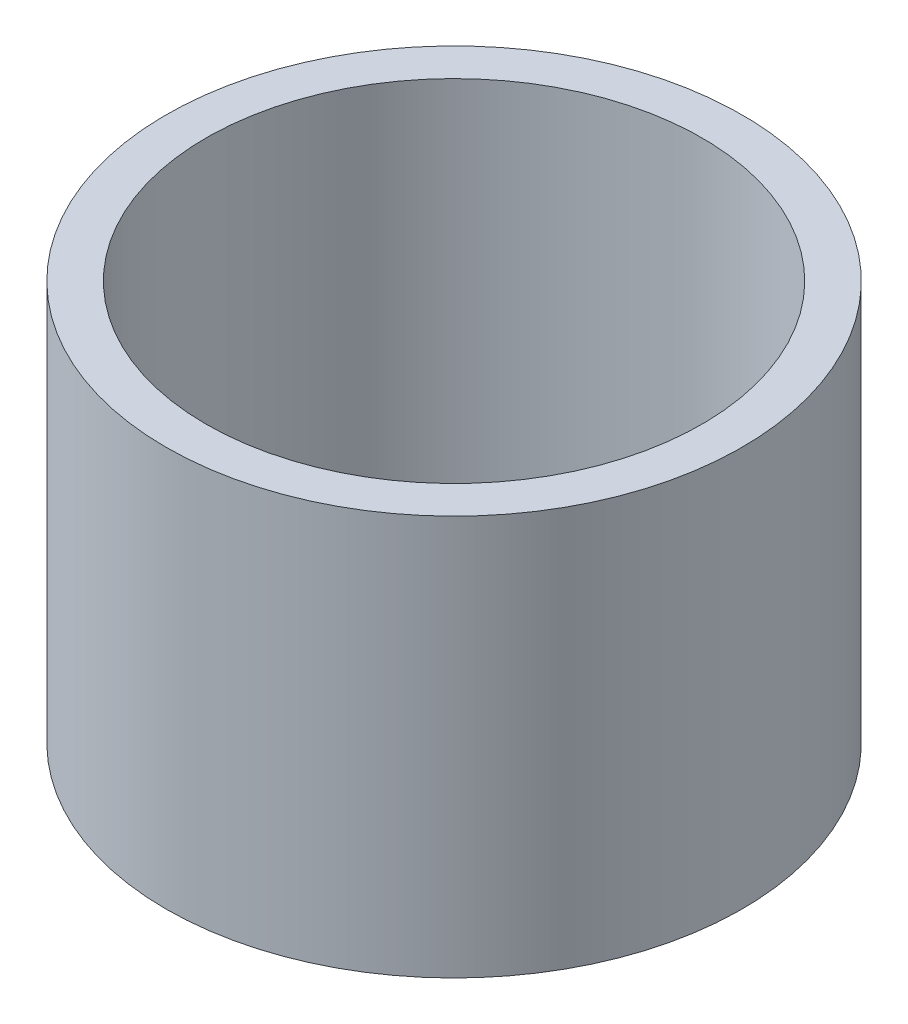
from build123d import *

# Parameters (mm, degrees)
SKETCH1_R           = 3.6
BOSS_EXTRUDE1_DEPTH = 5
SKETCH2_R           = 3.1
CUT_EXTRUDE1_DEPTH  = 4.5


with BuildPart() as part:
    # Sketch1 → Boss-Extrude1 (new body)
    with BuildSketch(Plane(origin=(0, 0, 0), x_dir=(1, 0, 0), z_dir=(0, 1, 0))):
        with Locations(Location((0, 0, 0), (0, 0, 270))):
            Circle(SKETCH1_R)
    extrude(amount=BOSS_EXTRUDE1_DEPTH)

    # Sketch2 → Cut-Extrude1 (cut)
    with BuildSketch(Plane(origin=(0, 5, 0), x_dir=(1, 0, 0), z_dir=(0, 1, 0))):
        with Locations(Location((0, 0, 0), (0, 0, 270))):
            Circle(SKETCH2_R)
    extrude(amount=-CUT_EXTRUDE1_DEPTH, mode=Mode.SUBTRACT)


solid = part.part
